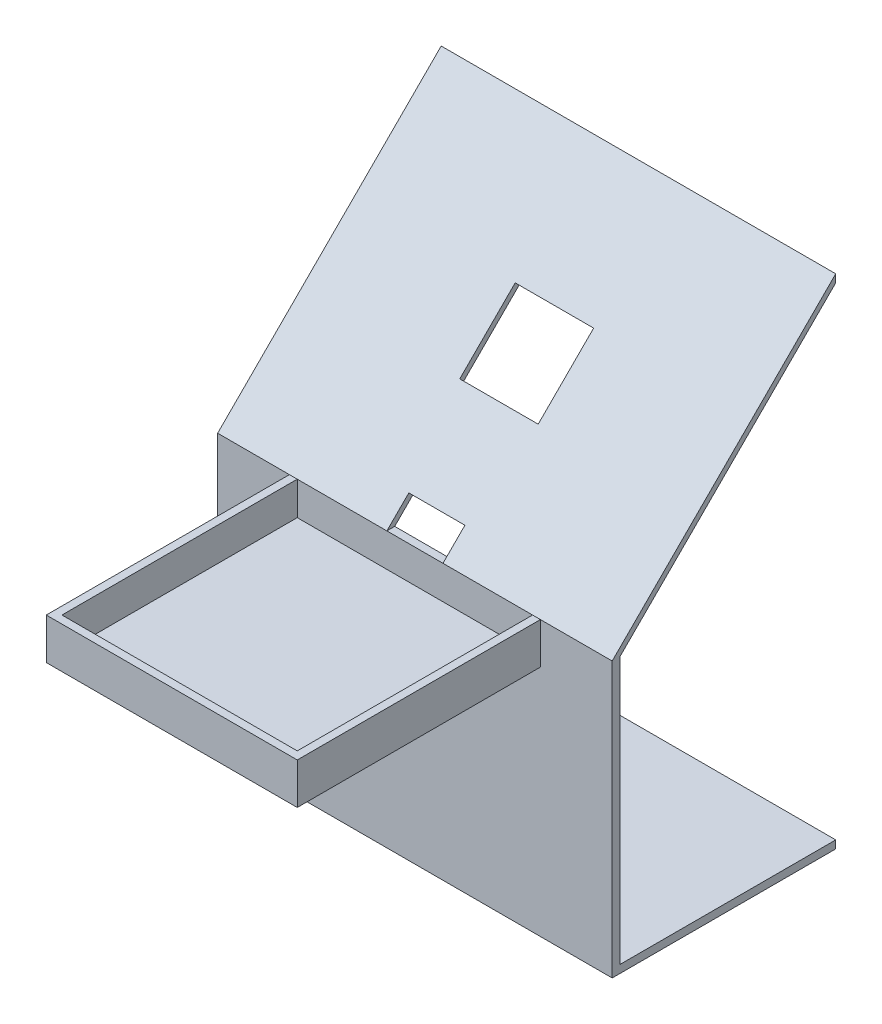
from build123d import *

# Parameters (mm, degrees)
CROQUIS1_W              = 100.6
CROQUIS1_H              = 55
SALIENTE_EXTRUIR1_DEPTH = 2
CROQUIS2_W              = 100.6
CROQUIS2_H              = 2
SALIENTE_EXTRUIR2_DEPTH = 70
SALIENTE_EXTRUIR3_DEPTH = 100.6
CROQUIS4_W              = 10
CROQUIS4_H              = 5.6
CROQUIS4_W_2            = 20
CROQUIS4_H_2            = 20
CORTAR_EXTRUIR1_DEPTH   = 1.414213562
CROQUIS5_R              = 1.5
CORTAR_EXTRUIR2_DEPTH   = 2
CROQUIS6_W              = 60
CROQUIS6_H              = 2
SALIENTE_EXTRUIR4_DEPTH = 60
SALIENTE_EXTRUIR5_REACH = 181.856
CROQUIS7_W              = 2
CROQUIS7_H              = 10.5
CROQUIS8_W              = 64
CROQUIS8_H              = 2
SALIENTE_EXTRUIR6_DEPTH = 10.5
CROQUIS9_W              = 10
CROQUIS9_H              = 2
SALIENTE_EXTRUIR7_DEPTH = 2
CROQUIS10_W             = 10
CROQUIS10_H             = 5.6
CORTAR_EXTRUIR3_DEPTH   = 11
CORTAR_EXTRUIR4_DEPTH   = 10


with BuildPart() as part:
    # Croquis1 → Saliente-Extruir1 (new body)
    with BuildSketch(Plane(origin=(0, 0, 0), x_dir=(1, 0, 0), z_dir=(0, 1, 0))):
        Rectangle(CROQUIS1_W, CROQUIS1_H)
    extrude(amount=SALIENTE_EXTRUIR1_DEPTH)

    # Croquis2 → Saliente-Extruir2 (add)
    with BuildSketch(Plane(origin=(0, 0, 0), x_dir=(-1, 0, 0), z_dir=(0, -1, 0))):
        with Locations((0, -28.5)):
            Rectangle(CROQUIS2_W, CROQUIS2_H)
    extrude(amount=-SALIENTE_EXTRUIR2_DEPTH)

    # Croquis3 → Saliente-Extruir3 (add)
    with BuildSketch(Plane(origin=(50.3, 0, 0), x_dir=(0, 0, -1), z_dir=(1, 0, 0))):
        Polygon((-29.5, 70), (27.5, 127), (27.5, 125), (-27.5, 70), align=None)
    extrude(amount=-SALIENTE_EXTRUIR3_DEPTH)

    # Croquis4 → Cortar-Extruir1 (cut)
    with BuildSketch(Plane(origin=(0, 49.75, 49.75), x_dir=(1, 0, 0), z_dir=(0, 0.7071067811865513, 0.7071067811865438))):
        with Locations((0, 31.437824638)):
            Rectangle(CROQUIS4_W, CROQUIS4_H)
        with Locations((0, 68.942911166)):
            Rectangle(CROQUIS4_W_2, CROQUIS4_H_2)
    extrude(amount=-CORTAR_EXTRUIR1_DEPTH, mode=Mode.SUBTRACT)

    # Croquis5 → Cortar-Extruir2 (cut)
    with BuildSketch(Plane.XY.offset(29.5)):
        with Locations((0, 51)):
            Circle(CROQUIS5_R)
    extrude(amount=-CORTAR_EXTRUIR2_DEPTH, mode=Mode.SUBTRACT)

    # Croquis6 → Saliente-Extruir4 (add)
    with BuildSketch(Plane.XY.offset(29.5)):
        with Locations((0, 60.5)):
            Rectangle(CROQUIS6_W, CROQUIS6_H)
    extrude(amount=SALIENTE_EXTRUIR4_DEPTH)

    # Saliente-Extruir5: up to this face of the body (flat: up to its plane)
    saliente_extruir5_end = Plane(part.part.faces().sort_by_distance((0, 34.541123817, 29.5))[0])
    # Croquis7 → Saliente-Extruir5 (add, up to the picked face)
    with BuildSketch(Plane.XY.offset(89.5), mode=Mode.PRIVATE) as saliente_extruir5_sk1:
        with Locations((31, 64.75)):
            Rectangle(CROQUIS7_W, CROQUIS7_H)
    saliente_extruir5_tool1 = split(extrude(saliente_extruir5_sk1.sketch, amount=-SALIENTE_EXTRUIR5_REACH, mode=Mode.PRIVATE), bisect_by=saliente_extruir5_end, keep=Keep.BOTH, mode=Mode.PRIVATE)
    # Croquis7 → Saliente-Extruir5 (add, up to the picked face)
    with BuildSketch(Plane.XY.offset(89.5), mode=Mode.PRIVATE) as saliente_extruir5_sk2:
        with Locations((-31, 64.75)):
            Rectangle(CROQUIS7_W, CROQUIS7_H)
    saliente_extruir5_tool2 = split(extrude(saliente_extruir5_sk2.sketch, amount=-SALIENTE_EXTRUIR5_REACH, mode=Mode.PRIVATE), bisect_by=saliente_extruir5_end, keep=Keep.BOTH, mode=Mode.PRIVATE)
    add(saliente_extruir5_tool1.solids().sort_by(Axis((31, 64.75, 89.5), (0, 0, -1)))[0])
    add(saliente_extruir5_tool2.solids().sort_by(Axis((-31, 64.75, 89.5), (0, 0, -1)))[0])

    # Croquis8 → Saliente-Extruir6 (add)
    with BuildSketch(Plane(origin=(0, 59.5, 0), x_dir=(-1, 0, 0), z_dir=(0, -1, 0))):
        with Locations((0, -90.5)):
            Rectangle(CROQUIS8_W, CROQUIS8_H)
    extrude(amount=-SALIENTE_EXTRUIR6_DEPTH)

    # Croquis9 → Saliente-Extruir7 (add)
    with BuildSketch(Plane(origin=(0, 0, 27.5), x_dir=(-1, 0, 0), z_dir=(0, 0, -1))):
        with Locations((0, 69)):
            Rectangle(CROQUIS9_W, CROQUIS9_H)
    extrude(amount=-SALIENTE_EXTRUIR7_DEPTH)

    # Croquis10 → Cortar-Extruir3 (cut)
    with BuildSketch(Plane.XY.offset(29.5)):
        with Locations((0, 72.8)):
            Rectangle(CROQUIS10_W, CROQUIS10_H)
    extrude(amount=-CORTAR_EXTRUIR3_DEPTH, mode=Mode.SUBTRACT)

    # Croquis11 → Cortar-Extruir4 (cut)
    with BuildSketch(Plane.XY.offset(29.5)):
        Polygon((0, 75.6), (7.15, 75.6), (7.15, 70), (-7.15, 70), (-7.15, 75.6), align=None)
    extrude(amount=-CORTAR_EXTRUIR4_DEPTH, mode=Mode.SUBTRACT)


solid = part.part
